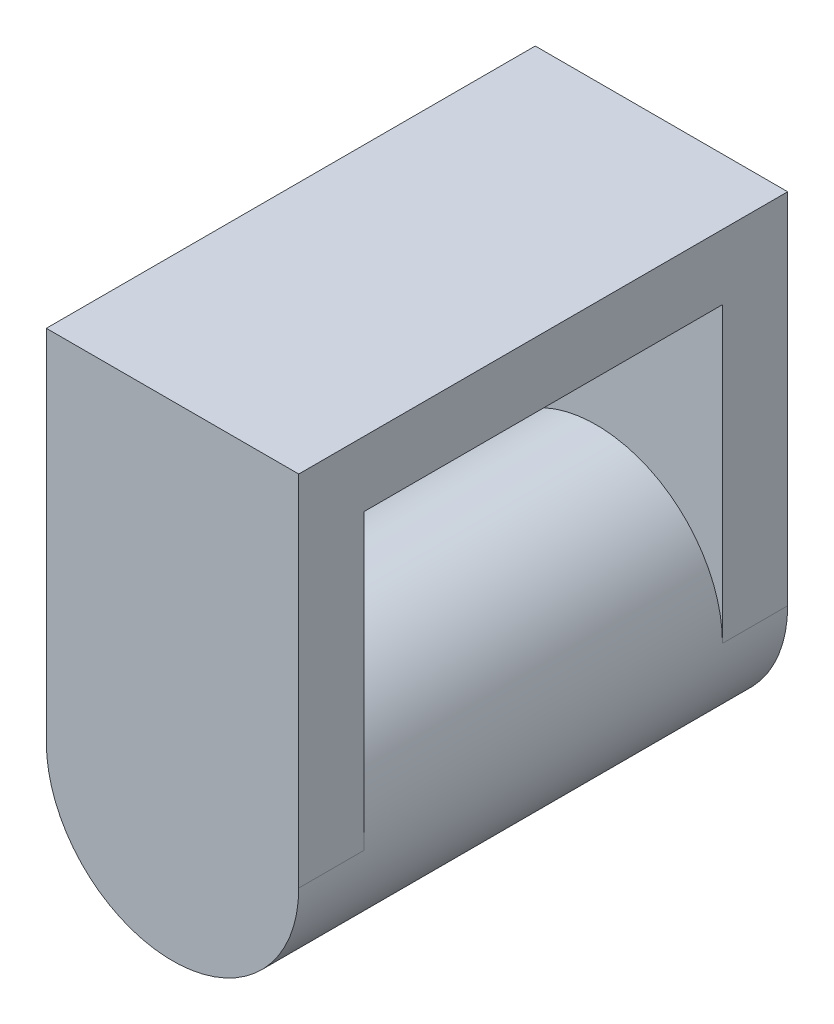
from build123d import *

# Parameters (mm, degrees)
SKETCH1_R             = 6.1468
BOSS_EXTRUDE1_DEPTH   = 8.73125
SKETCH1_W             = 12.2936
SKETCH1_H             = 3.175
BOSS_EXTRUDE1_2_DEPTH = 8.73125
BOSS_EXTRUDE2_START   = 3.175
BOSS_EXTRUDE2_DEPTH   = 3.175


with BuildPart() as part:
    # Sketch1 → Boss-Extrude1 (new, symmetric)
    with BuildSketch(Plane.XY):
        Circle(SKETCH1_R)
    extrude(amount=BOSS_EXTRUDE1_DEPTH, both=True)



with BuildPart() as body_2:
    # Sketch1 → Boss-Extrude1 2 (new, symmetric)
    with BuildSketch(Plane.XY):
        with Locations((0, 15.875)):
            Rectangle(SKETCH1_W, SKETCH1_H)
    extrude(amount=BOSS_EXTRUDE1_2_DEPTH, both=True)


with BuildPart() as part_1:
    add(part.part)

    add(body_2.part)  # Boss-Extrude2 merges body 2
    # Sketch2 → Boss-Extrude2 (add)
    with BuildSketch(Plane.XY.offset(8.73125).offset(BOSS_EXTRUDE2_START)):
        with BuildLine():
            Line((-6.1468, 0), (-6.1468, 17.4625))
            Line((-6.1468, 17.4625), (6.1468, 17.4625))
            Line((6.1468, 17.4625), (6.1468, 0))
            ThreePointArc((6.1468, 0), (0, -6.1468), (-6.1468, 0))
        make_face()
    boss_extrude2 = extrude(amount=-BOSS_EXTRUDE2_DEPTH)

    # Mirror1: Boss-Extrude2 across plane
    add(boss_extrude2.mirror(Plane.XY))


solid = part_1.part
